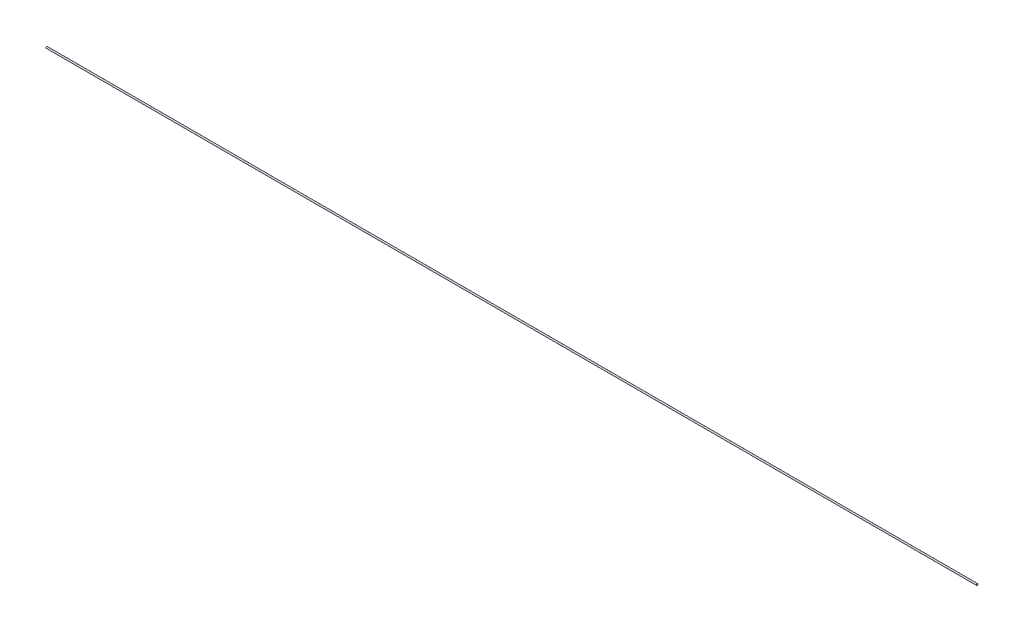
from build123d import *

# Parameters (mm, degrees)
SKETCH4_R           = 6.35
SKETCH4_R_2         = 5.842
BOSS_EXTRUDE1_DEPTH = 3810


with BuildPart() as part:
    # Sketch4 → Boss-Extrude1 (new, symmetric)
    with BuildSketch(Plane(origin=(0, 0, 0), x_dir=(0, 0, -1), z_dir=(1, 0, 0))):
        Circle(SKETCH4_R)
        Circle(SKETCH4_R_2, mode=Mode.SUBTRACT)
    extrude(amount=BOSS_EXTRUDE1_DEPTH, both=True)


solid = part.part
